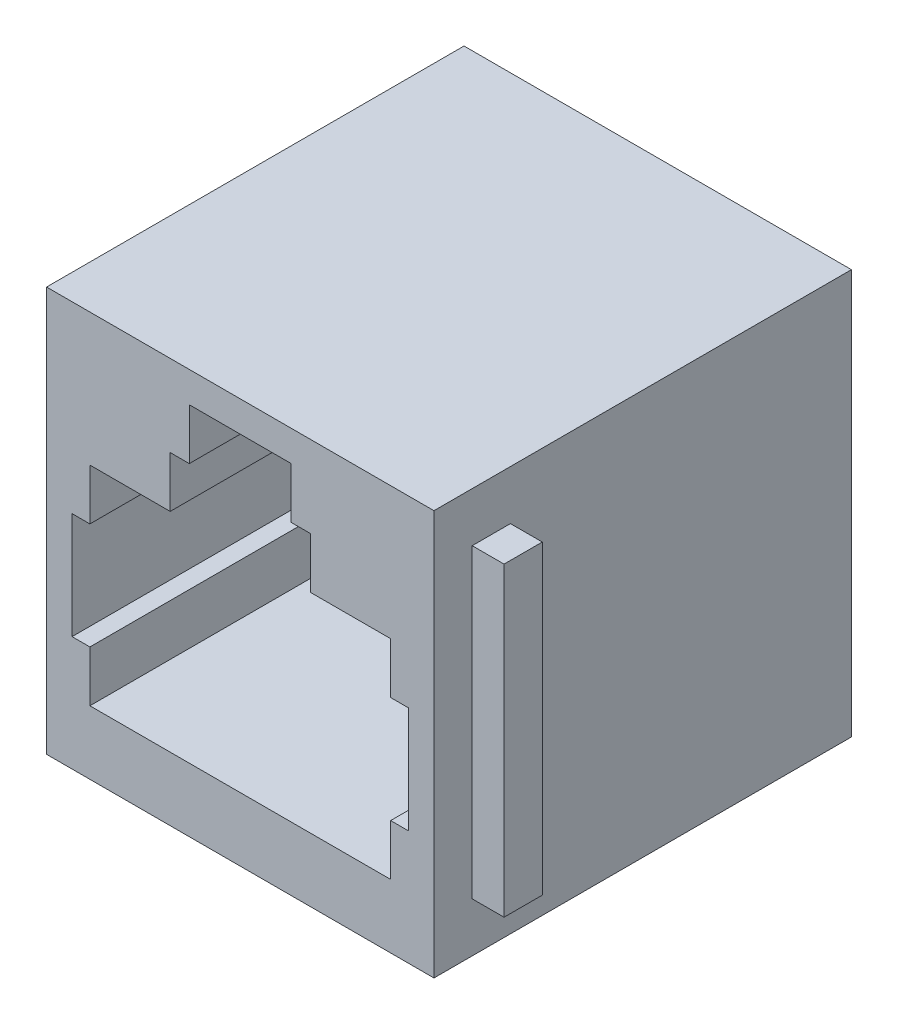
from build123d import *

# Parameters (mm, degrees)
SKETCH1_W           = 15.2
SKETCH1_H           = 15.88
BOSS_EXTRUDE1_DEPTH = 16.38
CUT_EXTRUDE1_DEPTH  = 15.38
SKETCH3_W           = 1.25
SKETCH3_H           = 1.5
BOSS_EXTRUDE2_DEPTH = 6


with BuildPart() as part:
    # Sketch1 → Boss-Extrude1 (new body)
    with BuildSketch(Plane.XY):
        Rectangle(SKETCH1_W, SKETCH1_H)
    extrude(amount=BOSS_EXTRUDE1_DEPTH)

    # Sketch2 → Cut-Extrude1 (cut)
    with BuildSketch(Plane.XY.offset(16.38)):
        Polygon((-2, 6.74), (2, 6.74), (2, 4.74), (2.75, 4.74), (2.75, 2.74), (5.9, 2.74), (5.9, 0.74), (6.6, 0.74), (6.6, -3.44), (5.9, -3.44), (5.9, -5.44), (-5.9, -5.44), (-5.9, -3.44), (-6.6, -3.44), (-6.6, 0.74), (-5.9, 0.74), (-5.9, 2.74), (-2.75, 2.74), (-2.75, 4.74), (-2, 4.74), align=None)
    extrude(amount=-CUT_EXTRUDE1_DEPTH, mode=Mode.SUBTRACT)

    # Sketch3 → Boss-Extrude2 (add, symmetric)
    with BuildSketch(Plane(origin=(0, 0, 0), x_dir=(1, 0, 0), z_dir=(0, 1, 0))):
        with Locations((8.225, -14.13)):
            Rectangle(SKETCH3_W, SKETCH3_H)
        with Locations((-8.225, -14.13)):
            Rectangle(SKETCH3_W, SKETCH3_H)
    extrude(amount=BOSS_EXTRUDE2_DEPTH, both=True)


solid = part.part
